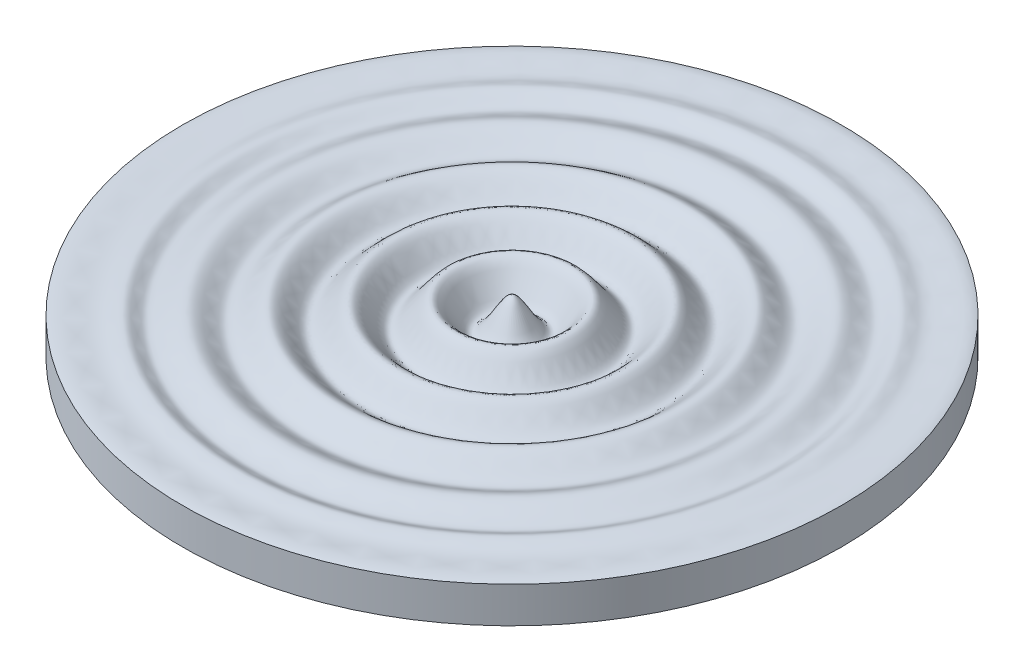
from build123d import *


with BuildPart() as part:
    # Esboço1 → Revolução1 (revolve)
    with BuildSketch(Plane.XY, mode=Mode.PRIVATE) as revolu_o1_sk:
        with BuildLine():
            Line((-457.049532745, 0), (-457.049532745, -50))
            Line((-457.049532745, -50), (0, -50))
            Line((0, -50), (0, 24.144140097))
            add(Edge.make_bspline(
                [(0, 24.144140097), (-12.209720323, 24.003890948), (-33.266714697, -44.817019015), (-59.285691478, -0.177228888), (-80.138661294, 29.900999495), (-99.25282109, 0.078250012), (-120.117298717, -26.735154481), (-139.239489854, 0.029883345), (-160.090501003, 23.569365526), (-179.239234222, -0.147281171), (-200.059917929, -20.40301596), (-219.254947939, 0.271372317), (-240.024125117, 17.236214767), (-259.292775463, -0.399727216), (-279.971932068, -14.062090924), (-299.129600383, 0.304074246), (-319.487672972, 10.853193763), (-339.045386029, 0.062243096), (-360.756482051, -9.862614167), (-378.777323885, 8.994856998), (-412.136080412, -8.271928575), (-437.918016299, 5.609810256), (-457.049532745, 0)],
                knots=[0, 0, 0, 0, 0.110465463, 0.164248316, 0.215267975, 0.266287635, 0.314687759, 0.363087883, 0.409036706, 0.454985529, 0.498679609, 0.542373688, 0.584041502, 0.625709317, 0.665614164, 0.705519012, 0.742350471, 0.782474605, 0.819787402, 0.859583539, 0.896467537, 1, 1, 1, 1], degree=3))
        make_face()
    revolve(revolu_o1_sk.sketch.rotate(Axis((0, -1000, 0), (0, 1, 0)), 180), axis=Axis((0, -1000, 0), (0, 1, 0)))


solid = part.part
